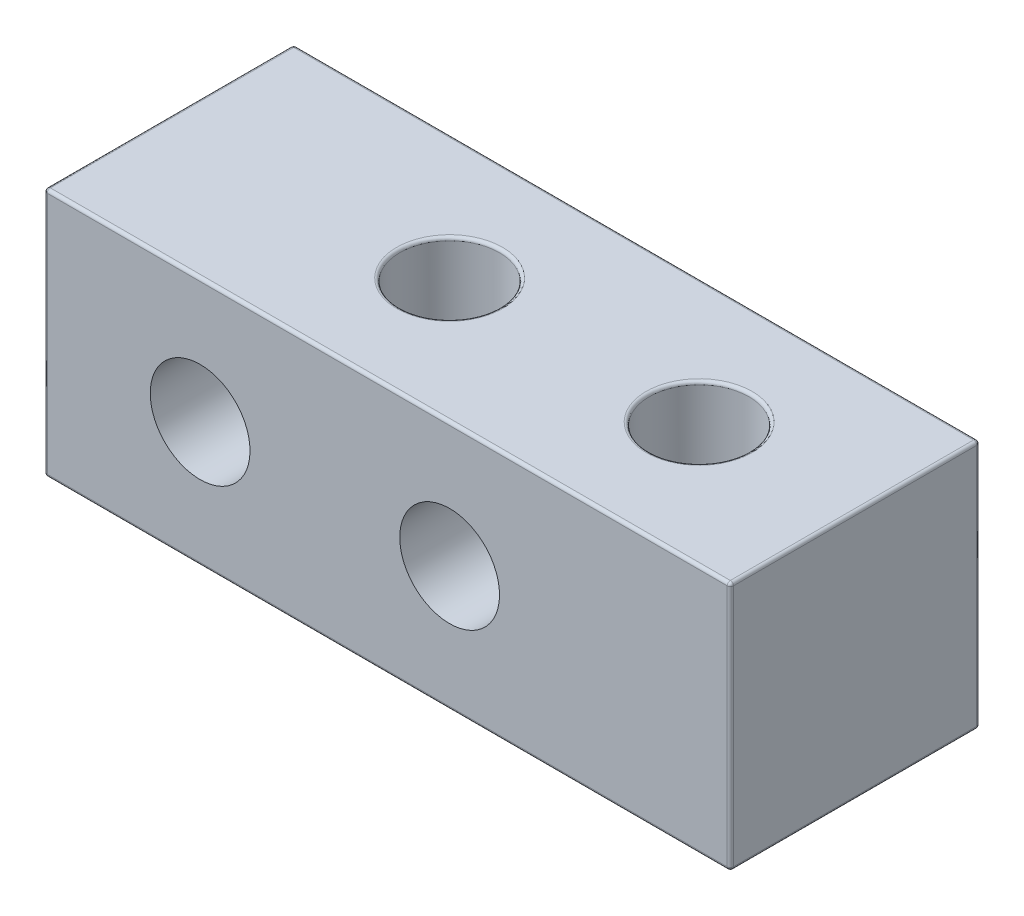
from build123d import *

# Parameters (mm, degrees)
SKETCH_1_W          = 22
SKETCH_1_H          = 8
EXTRUDE_1_DEPTH     = 8
SKETCH_2_R          = 1.6
CUT_EXTRUDE_1_DEPTH = 25.738633754
SKETCH_3_R          = 1.6
CUT_EXTRUDE_2_DEPTH = 25.738633754
FILLET_1_R          = 0.1


with BuildPart() as part:
    # 草图1 → 凸台-拉伸1 (new body)
    with BuildSketch(Plane.XY):
        with Locations((11, -4)):
            Rectangle(SKETCH_1_W, SKETCH_1_H)
    extrude(amount=EXTRUDE_1_DEPTH)

    # 草图2 → 切除-拉伸1 (cut, through all)
    with BuildSketch(Plane.XY.offset(8)):
        with Locations((5, -4)):
            Circle(SKETCH_2_R)
        with Locations((13, -4)):
            Circle(SKETCH_2_R)
    extrude(amount=-CUT_EXTRUDE_1_DEPTH, mode=Mode.SUBTRACT)

    # 草图3 → 切除-拉伸2 (cut, through all)
    with BuildSketch(Plane(origin=(0, 0, 0), x_dir=(1, 0, 0), z_dir=(0, 1, 0))):
        with Locations(Location((17, -4, 0), (0, 0, 270))):
            Circle(SKETCH_3_R)
        with Locations(Location((9, -4, 0), (0, 0, 270))):
            Circle(SKETCH_3_R)
    extrude(amount=-CUT_EXTRUDE_2_DEPTH, mode=Mode.SUBTRACT)

    # 圆角1
    fillet_1_edges = [part.edges().sort_by_distance(p)[0] for p in [
        (22, -4, 8),
        (11, 0, 8),
        (3.4, -4, 0),
        (11.4, -4, 0),
        (17, 0, 2.4),
        (9, 0, 2.4),
        (0, -4, 8),
        (11, 0, 0),
        (22, -4, 0),
        (11, -8, 0),
        (0, -4, 0),
        (0, 0, 4),
        (22, 0, 4),
        (22, -8, 4),
        (0, -8, 4),
        (11, -8, 8),
    ]]
    fillet(fillet_1_edges, radius=FILLET_1_R)


solid = part.part
